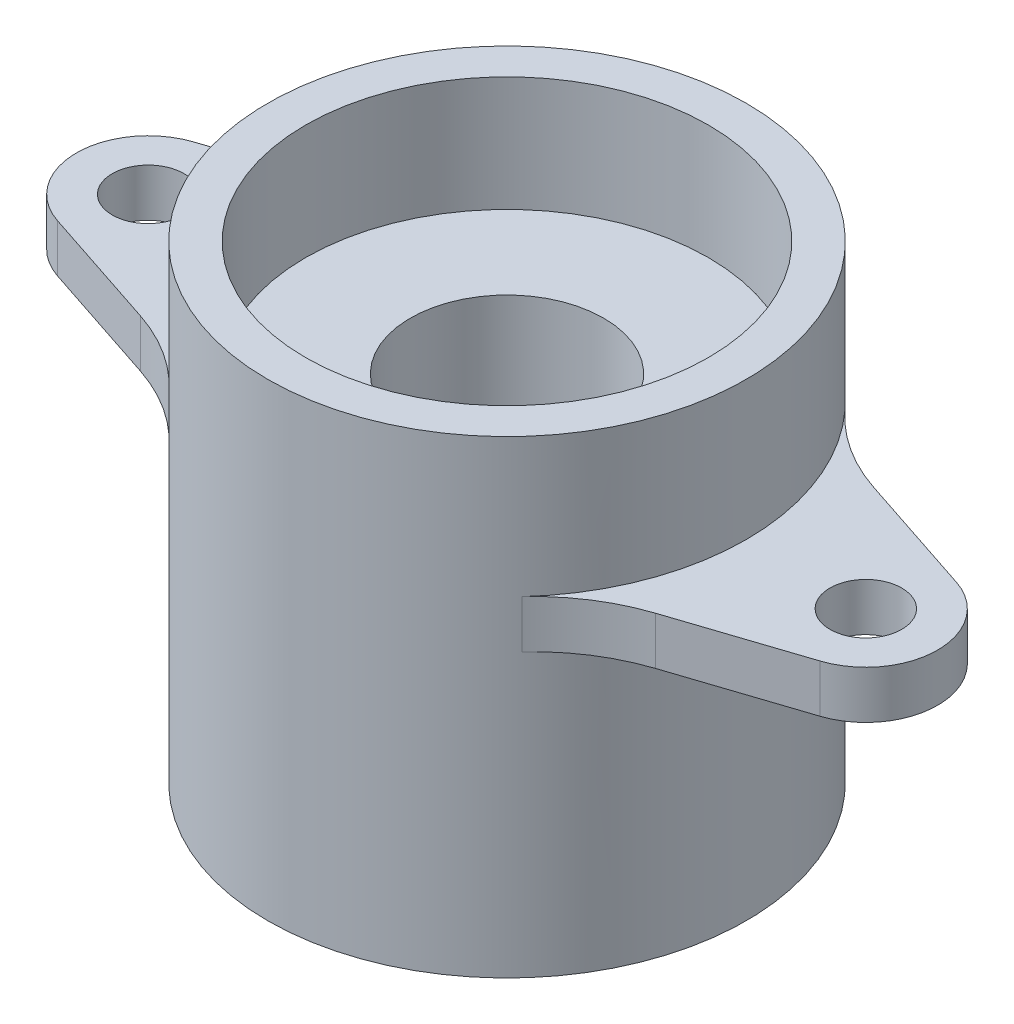
from build123d import *

# Parameters (mm, degrees)
BOSS_EXTRUDE1_START = 5
SKETCH2_R           = 3.75
BOSS_EXTRUDE1_DEPTH = 5


with BuildPart() as part:
    # Sketch1 → Revolve1 (revolve)
    with BuildSketch(Plane.XY, mode=Mode.PRIVATE) as revolve1_sk:
        Polygon((21.05, 24.5), (25, 24.5), (25, -24.5), (21.05, -24.5), (21.05, -12.5), (10.1, -12.5), (10.1, 12.5), (21.05, 12.5), align=None)
    revolve(revolve1_sk.sketch.rotate(Axis((0, 0, 0), (0, 1, 0)), 90), axis=Axis((0, 0, 0), (0, 1, 0)))

    # Sketch2 → Boss-Extrude1 (add)
    # profile 1 of 2: a face of its own
    with BuildSketch(Plane(origin=(0, 0, 0), x_dir=(1, 0, 0), z_dir=(0, 1, 0)).offset(BOSS_EXTRUDE1_START)):
        with BuildLine():
            Line((-39.854181584, 7.12094299), (-26.911060299, 11.399934945))
            ThreePointArc((-26.911060299, 11.399934945), (-22.323138818, 13.598174791), (-18.438265476, 16.882842362))
            Line((-18.438265476, 16.882842362), (-18.438265476, -16.882842362))
            ThreePointArc((-18.438265476, -16.882842362), (-22.323138818, -13.598174791), (-26.911060299, -11.399934945))
            Line((-26.911060299, -11.399934945), (-39.854181584, -7.12094299))
            ThreePointArc((-39.854181584, -7.12094299), (-45, 0), (-39.854181584, 7.12094299))
        make_face()
        with Locations(Location((-37.5, 0, 0), (0, 0, 270))):
            Circle(SKETCH2_R, mode=Mode.SUBTRACT)
    # profile 2 of 2: a face of its own
    with BuildSketch(Plane(origin=(0, 0, 0), x_dir=(1, 0, 0), z_dir=(0, 1, 0)).offset(BOSS_EXTRUDE1_START)):
        with BuildLine():
            Line((18.438265476, 16.882842362), (18.438265476, -16.882842362))
            ThreePointArc((18.438265476, -16.882842362), (22.323138818, -13.598174791), (26.911060299, -11.399934945))
            Line((26.911060299, -11.399934945), (39.854181584, -7.12094299))
            ThreePointArc((39.854181584, -7.12094299), (45, 0), (39.854181584, 7.12094299))
            Line((39.854181584, 7.12094299), (26.911060299, 11.399934945))
            ThreePointArc((26.911060299, 11.399934945), (22.323138818, 13.598174791), (18.438265476, 16.882842362))
        make_face()
        with Locations(Location((37.5, 0, 0), (0, 0, 90))):
            Circle(SKETCH2_R, mode=Mode.SUBTRACT)
    extrude(amount=BOSS_EXTRUDE1_DEPTH)


solid = part.part
